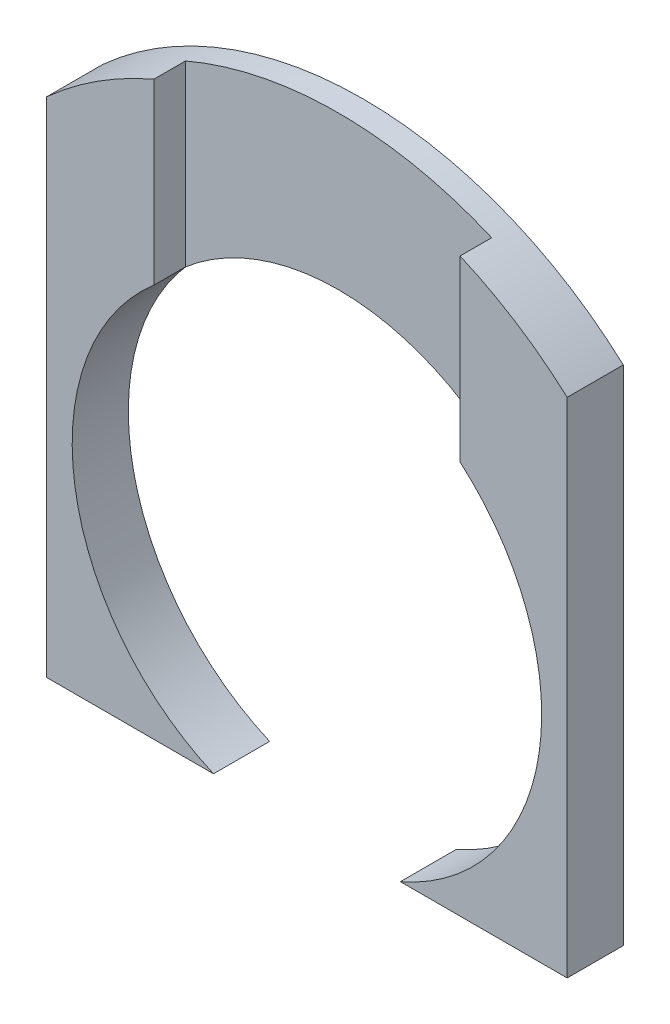
from build123d import *

# Parameters (mm, degrees)
S_CYL1_R       = 19
BOSS_1_DEPTH   = 2.75
S_HOLE2_R      = 11.5
HOLE_2_DEPTH   = 2.95
S_CUT3_W       = 7.25
S_CUT3_H       = 40
POCKET_3_DEPTH = 2.95
S_CUT4_W       = 7.25
S_CUT4_H       = 40
POCKET_4_DEPTH = 2.95
S_CUT5_W       = 40
S_CUT5_H       = 9.45
POCKET_5_DEPTH = 2.95
S_CUT6_W       = 15
S_CUT6_H       = 11.9
POCKET_6_DEPTH = 1.65


with BuildPart() as part:
    # S_cyl1 → Boss_1 (new body)
    with BuildSketch(Plane.XY.offset(30.1)):
        Circle(S_CYL1_R)
    extrude(amount=BOSS_1_DEPTH)

    # S_hole2 → Hole_2 (cut)
    with BuildSketch(Plane.XY.offset(30)):
        with Locations(Location((0, 0, 0), (0, 0, 180))):
            Circle(S_HOLE2_R)
    extrude(amount=HOLE_2_DEPTH, mode=Mode.SUBTRACT)

    # S_cut3 → Pocket_3 (cut)
    with BuildSketch(Plane.XY.offset(30)):
        with Locations((16.375, 0)):
            Rectangle(S_CUT3_W, S_CUT3_H)
    extrude(amount=POCKET_3_DEPTH, mode=Mode.SUBTRACT)

    # S_cut4 → Pocket_4 (cut)
    with BuildSketch(Plane.XY.offset(30)):
        with Locations((-16.375, 0)):
            Rectangle(S_CUT4_W, S_CUT4_H)
    extrude(amount=POCKET_4_DEPTH, mode=Mode.SUBTRACT)

    # S_cut5 → Pocket_5 (cut)
    with BuildSketch(Plane.XY.offset(30)):
        with Locations((0, -15.275)):
            Rectangle(S_CUT5_W, S_CUT5_H)
    extrude(amount=POCKET_5_DEPTH, mode=Mode.SUBTRACT)

    # S_cut6 → Pocket_6 (cut)
    with BuildSketch(Plane.XY.offset(31.3)):
        with Locations((0, 14.05)):
            Rectangle(S_CUT6_W, S_CUT6_H)
    extrude(amount=POCKET_6_DEPTH, mode=Mode.SUBTRACT)


solid = part.part
